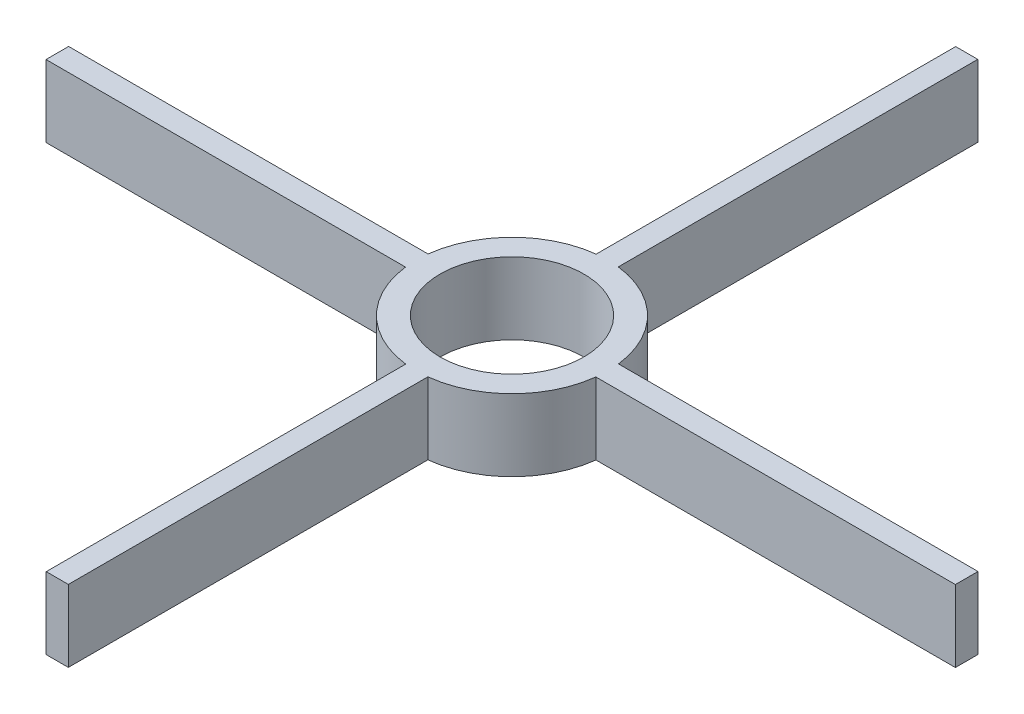
from build123d import *

# Parameters (mm, degrees)
SKETCH1_R           = 30
BOSS_EXTRUDE2_DEPTH = 15


with BuildPart() as part:
    # Sketch1 → Boss-Extrude2 (new, symmetric)
    with BuildSketch(Plane(origin=(0, 0, 0), x_dir=(1, 0, 0), z_dir=(0, 1, 0))):
        with BuildLine():
            Line((-4.614869531, 39.732895429), (-4.614869531, 189.732895429))
            Line((-4.614869531, 189.732895429), (4.614869531, 189.732895429))
            Line((4.614869531, 189.732895429), (4.614869531, 39.732895429))
            ThreePointArc((4.614869531, 39.732895429), (28.246736926, 28.321755825), (39.720515579, 4.720237505))
            Line((39.720515579, 4.720237505), (189.720515579, 4.720237505))
            Line((189.720515579, 4.720237505), (189.720515579, -4.720237505))
            Line((189.720515579, -4.720237505), (39.720515579, -4.720237505))
            ThreePointArc((39.720515579, -4.720237505), (28.246736926, -28.321755825), (4.614869531, -39.732895429))
            Line((4.614869531, -39.732895429), (4.614869531, -189.732895429))
            Line((4.614869531, -189.732895429), (-4.614869531, -189.732895429))
            Line((-4.614869531, -189.732895429), (-4.614869531, -39.732895429))
            ThreePointArc((-4.614869531, -39.732895429), (-28.246736926, -28.321755825), (-39.720515579, -4.720237505))
            Line((-39.720515579, -4.720237505), (-189.720515579, -4.720237505))
            Line((-189.720515579, -4.720237505), (-189.720515579, 4.720237505))
            Line((-189.720515579, 4.720237505), (-39.720515579, 4.720237505))
            ThreePointArc((-39.720515579, 4.720237505), (-28.246736926, 28.321755825), (-4.614869531, 39.732895429))
        make_face()
        with Locations(Location((0, 0, 0), (0, 0, 270))):
            Circle(SKETCH1_R, mode=Mode.SUBTRACT)
    extrude(amount=BOSS_EXTRUDE2_DEPTH, both=True)


solid = part.part
